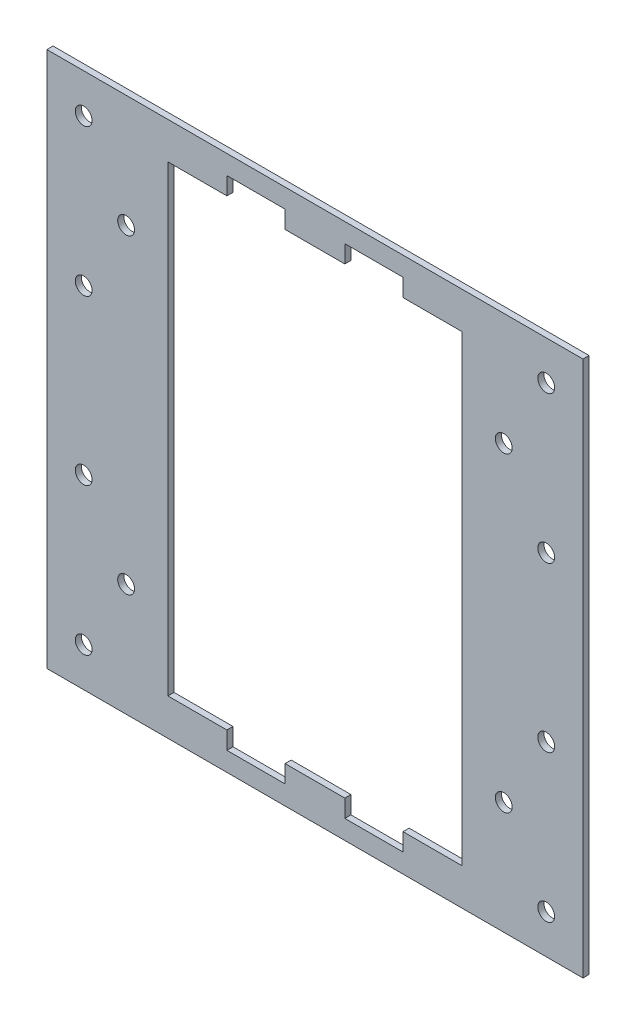
from build123d import *

# Parameters (mm, degrees)
SKETCH_1_W                      = 700
SKETCH_1_H                      = 700
CONNECTION_PLATE_DEPTH          = 8
SKETCH_2_W                      = 76
SKETCH_2_H                      = 300
ACCESS_WINDOW_DEPTH             = 990.981818015
SKETCH_3_W                      = 76
SKETCH_3_H                      = 300
CUT_EXTRUDE_2_DEPTH             = 990.981818015
SKETCH_4_W                      = 76
SKETCH_4_H                      = 300
CUT_EXTRUDE_3_DEPTH             = 990.981818015
SKETCH_5_W                      = 76
SKETCH_5_H                      = 300
CUT_EXTRUDE_4_DEPTH             = 990.981818015
SKETCH_6_R                      = 11
SHAFT_CLEARANCE_DEPTH           = 990.981818015
SKETCH_7_R                      = 11
CUT_EXTRUDE_6_DEPTH             = 990.981818015
SKETCH_8_R                      = 11
CUT_EXTRUDE_7_DEPTH             = 990.981818015
SKETCH_9_R                      = 11
CUT_EXTRUDE_8_DEPTH             = 990.981818015
SKETCH_10_R                     = 11
CUT_EXTRUDE_9_DEPTH             = 990.981818015
SKETCH_11_R                     = 11
CUT_EXTRUDE_10_DEPTH            = 990.981818015
SKETCH_12_R                     = 11
CUT_EXTRUDE_11_DEPTH            = 990.981818015
SKETCH_13_R                     = 11
CUT_EXTRUDE_12_DEPTH            = 990.981818015
SKETCH_14_R                     = 11
CUT_EXTRUDE_13_DEPTH            = 990.981818015
SKETCH_15_R                     = 11
CUT_EXTRUDE_14_DEPTH            = 990.981818015
SKETCH_16_R                     = 11
CUT_EXTRUDE_15_DEPTH            = 990.981818015
SKETCH_17_R                     = 11
CUT_EXTRUDE_16_DEPTH            = 990.981818015
SKETCH_18_W                     = 384
SKETCH_18_H                     = 604
FLOAT_INSTALLATION_WINDOW_DEPTH = 990.981818015


with BuildPart() as part:
    # 草图1 → Connection_plate (new body)
    with BuildSketch(Plane.XY):
        with Locations((350, 350)):
            Rectangle(SKETCH_1_W, SKETCH_1_H)
    extrude(amount=CONNECTION_PLATE_DEPTH)

    # 草图2 → Access_window (cut, through all)
    with BuildSketch(Plane.XY.offset(8)):
        with Locations((273, 175)):
            Rectangle(SKETCH_2_W, SKETCH_2_H)
    extrude(amount=-ACCESS_WINDOW_DEPTH, mode=Mode.SUBTRACT)

    # 草图3 → 切除-拉伸2 (cut, through all)
    with BuildSketch(Plane.XY.offset(8)):
        with Locations((273, 525)):
            Rectangle(SKETCH_3_W, SKETCH_3_H)
    extrude(amount=-CUT_EXTRUDE_2_DEPTH, mode=Mode.SUBTRACT)

    # 草图4 → 切除-拉伸3 (cut, through all)
    with BuildSketch(Plane.XY.offset(8)):
        with Locations((427, 175)):
            Rectangle(SKETCH_4_W, SKETCH_4_H)
    extrude(amount=-CUT_EXTRUDE_3_DEPTH, mode=Mode.SUBTRACT)

    # 草图5 → 切除-拉伸4 (cut, through all)
    with BuildSketch(Plane.XY.offset(8)):
        with Locations((427, 525)):
            Rectangle(SKETCH_5_W, SKETCH_5_H)
    extrude(amount=-CUT_EXTRUDE_4_DEPTH, mode=Mode.SUBTRACT)

    # 草图6 → Shaft_clearance (cut, through all)
    with BuildSketch(Plane.XY.offset(8)):
        with Locations((48, 51)):
            Circle(SKETCH_6_R)
    extrude(amount=-SHAFT_CLEARANCE_DEPTH, mode=Mode.SUBTRACT)

    # 草图7 → 切除-拉伸6 (cut, through all)
    with BuildSketch(Plane.XY.offset(8)):
        with Locations((48, 243)):
            Circle(SKETCH_7_R)
    extrude(amount=-CUT_EXTRUDE_6_DEPTH, mode=Mode.SUBTRACT)

    # 草图8 → 切除-拉伸7 (cut, through all)
    with BuildSketch(Plane.XY.offset(8)):
        with Locations((48, 457)):
            Circle(SKETCH_8_R)
    extrude(amount=-CUT_EXTRUDE_7_DEPTH, mode=Mode.SUBTRACT)

    # 草图9 → 切除-拉伸8 (cut, through all)
    with BuildSketch(Plane.XY.offset(8)):
        with Locations((48, 649)):
            Circle(SKETCH_9_R)
    extrude(amount=-CUT_EXTRUDE_8_DEPTH, mode=Mode.SUBTRACT)

    # 草图10 → 切除-拉伸9 (cut, through all)
    with BuildSketch(Plane.XY.offset(8)):
        with Locations((103.43, 147)):
            Circle(SKETCH_10_R)
    extrude(amount=-CUT_EXTRUDE_9_DEPTH, mode=Mode.SUBTRACT)

    # 草图11 → 切除-拉伸10 (cut, through all)
    with BuildSketch(Plane.XY.offset(8)):
        with Locations((103.43, 553)):
            Circle(SKETCH_11_R)
    extrude(amount=-CUT_EXTRUDE_10_DEPTH, mode=Mode.SUBTRACT)

    # 草图12 → 切除-拉伸11 (cut, through all)
    with BuildSketch(Plane.XY.offset(8)):
        with Locations((652, 51)):
            Circle(SKETCH_12_R)
    extrude(amount=-CUT_EXTRUDE_11_DEPTH, mode=Mode.SUBTRACT)

    # 草图13 → 切除-拉伸12 (cut, through all)
    with BuildSketch(Plane.XY.offset(8)):
        with Locations((652, 243)):
            Circle(SKETCH_13_R)
    extrude(amount=-CUT_EXTRUDE_12_DEPTH, mode=Mode.SUBTRACT)

    # 草图14 → 切除-拉伸13 (cut, through all)
    with BuildSketch(Plane.XY.offset(8)):
        with Locations((652, 457)):
            Circle(SKETCH_14_R)
    extrude(amount=-CUT_EXTRUDE_13_DEPTH, mode=Mode.SUBTRACT)

    # 草图15 → 切除-拉伸14 (cut, through all)
    with BuildSketch(Plane.XY.offset(8)):
        with Locations((652, 649)):
            Circle(SKETCH_15_R)
    extrude(amount=-CUT_EXTRUDE_14_DEPTH, mode=Mode.SUBTRACT)

    # 草图16 → 切除-拉伸15 (cut, through all)
    with BuildSketch(Plane.XY.offset(8)):
        with Locations((596.57, 147)):
            Circle(SKETCH_16_R)
    extrude(amount=-CUT_EXTRUDE_15_DEPTH, mode=Mode.SUBTRACT)

    # 草图17 → 切除-拉伸16 (cut, through all)
    with BuildSketch(Plane.XY.offset(8)):
        with Locations((596.57, 553)):
            Circle(SKETCH_17_R)
    extrude(amount=-CUT_EXTRUDE_16_DEPTH, mode=Mode.SUBTRACT)

    # 草图18 → Float_installation_window (cut, through all)
    with BuildSketch(Plane.XY.offset(8)):
        with Locations((350, 350)):
            Rectangle(SKETCH_18_W, SKETCH_18_H)
    extrude(amount=-FLOAT_INSTALLATION_WINDOW_DEPTH, mode=Mode.SUBTRACT)


solid = part.part
